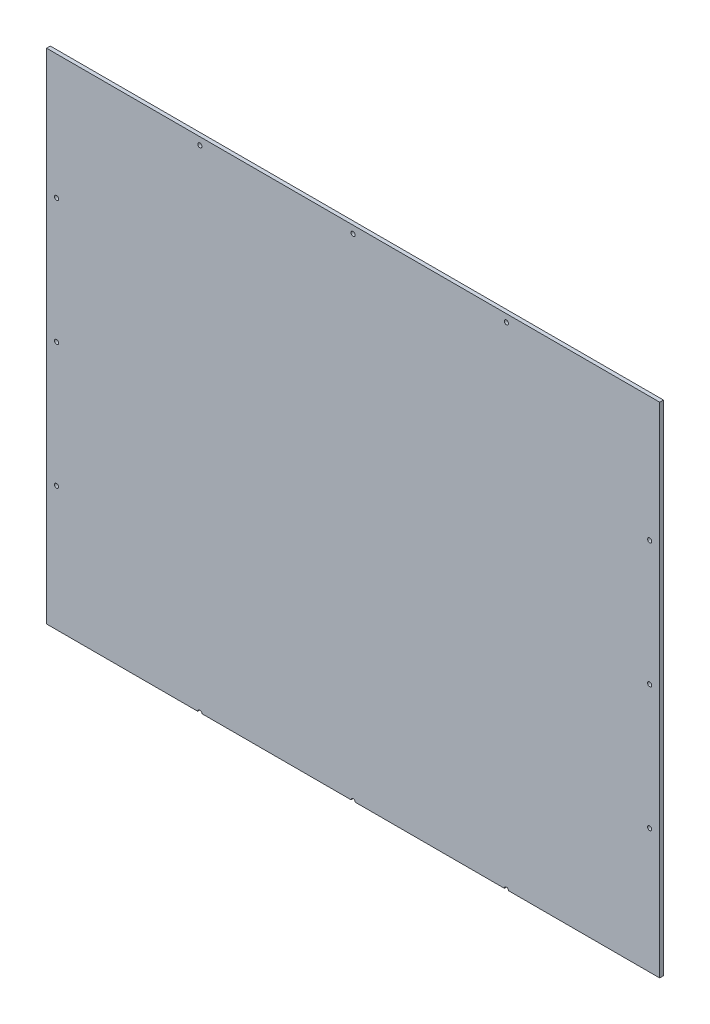
from build123d import *

# Parameters (mm, degrees)
SKETCH1_W           = 734
SKETCH1_H           = 597
BOSS_EXTRUDE1_DEPTH = 4.5
SKETCH2_R           = 2.5
CUT_EXTRUDE1_DEPTH  = 10


with BuildPart() as part:
    # Sketch1 → Boss-Extrude1 (new body)
    with BuildSketch(Plane.XY):
        with Locations((0, -0.004701973)):
            Rectangle(SKETCH1_W, SKETCH1_H)
    extrude(amount=BOSS_EXTRUDE1_DEPTH)

    # Sketch2 → Cut-Extrude1 (cut)
    with BuildSketch(Plane.XY.offset(4.5)):
        with Locations((-355, -149.254548242)):
            Circle(SKETCH2_R)
        with Locations((-355, -0.004548242)):
            Circle(SKETCH2_R)
        with Locations((-355, 149.245451758)):
            Circle(SKETCH2_R)
        with Locations((355, -149.254548242)):
            Circle(SKETCH2_R)
        with Locations((355, -0.004548242)):
            Circle(SKETCH2_R)
        with Locations((355, 149.245451758)):
            Circle(SKETCH2_R)
        with Locations((0, 289.495298027)):
            Circle(SKETCH2_R)
        with Locations((183.5, 289.495298027)):
            Circle(SKETCH2_R)
        with Locations((-183.5, 289.495298027)):
            Circle(SKETCH2_R)
        with Locations((0, -298.449910957)):
            Circle(SKETCH2_R)
        with Locations((183.5, -298.449910957)):
            Circle(SKETCH2_R)
        with Locations((-183.5, -298.449910957)):
            Circle(SKETCH2_R)
    extrude(amount=-CUT_EXTRUDE1_DEPTH, mode=Mode.SUBTRACT)


solid = part.part
